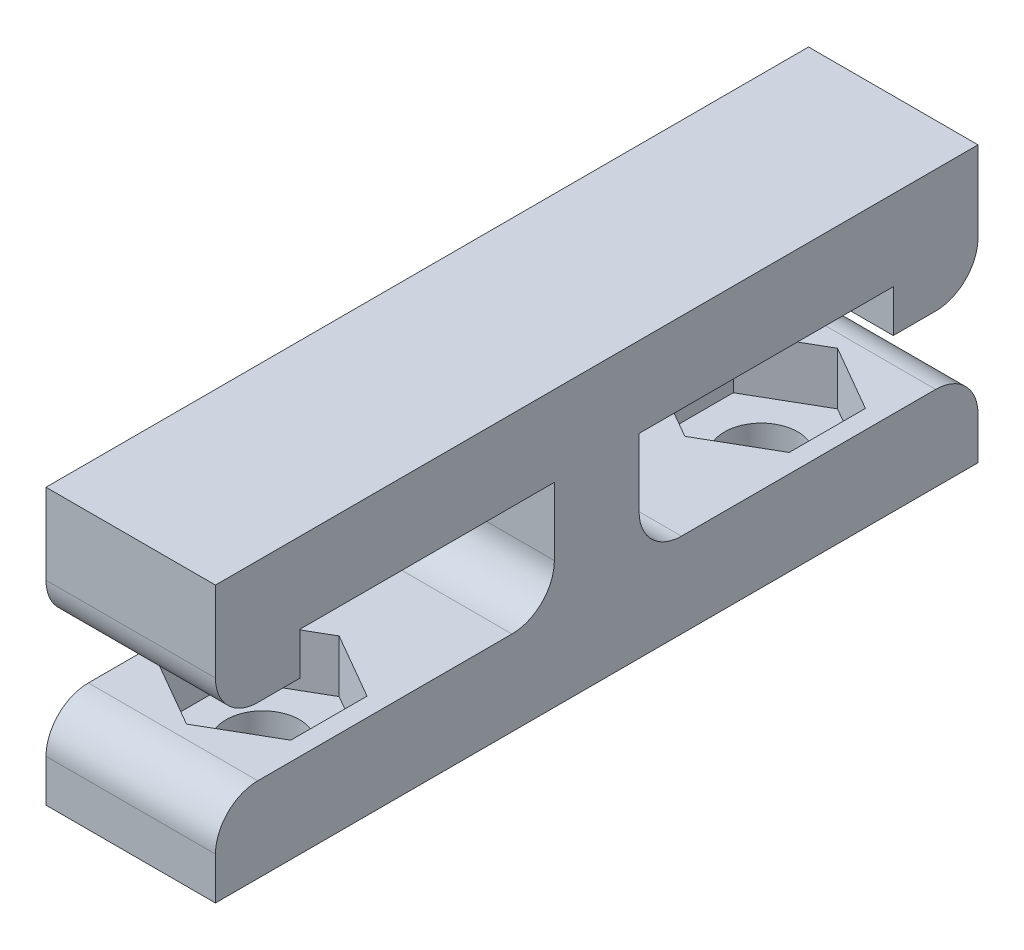
from build123d import *

# Parameters (mm, degrees)
SKETCH1_W           = 10
SKETCH1_H           = 45
SKETCH1_R           = 2.16
BOSS_EXTRUDE1_DEPTH = 5
CUT_EXTRUDE1_DEPTH  = 3.1
BOSS_EXTRUDE2_DEPTH = 10
FILLET1_R           = 2.5


with BuildPart() as part:
    # Sketch1 → Boss-Extrude1 (new body)
    with BuildSketch(Plane(origin=(0, 0, 0), x_dir=(1, 0, 0), z_dir=(0, 1, 0))):
        with Locations((5, 22.5)):
            Rectangle(SKETCH1_W, SKETCH1_H)
        with Locations(Location((5, 37.205, 0), (0, 0, 270))):
            Circle(SKETCH1_R, mode=Mode.SUBTRACT)
        with Locations(Location((5, 7.795, 0), (0, 0, 270))):
            Circle(SKETCH1_R, mode=Mode.SUBTRACT)
    extrude(amount=BOSS_EXTRUDE1_DEPTH)

    # Sketch2 → Cut-Extrude1 (cut)
    with BuildSketch(Plane(origin=(0, 5, 0), x_dir=(1, 0, 0), z_dir=(0, 1, 0))):
        Polygon((5, 32.7016679), (8.9, 34.95333395), (8.9, 39.45666605), (5, 41.7083321), (1.1, 39.45666605), (1.1, 34.95333395), align=None)
        Polygon((5, 12.2983321), (1.1, 10.04666605), (1.1, 5.54333395), (5, 3.2916679), (8.9, 5.54333395), (8.9, 10.04666605), align=None)
    extrude(amount=-CUT_EXTRUDE1_DEPTH, mode=Mode.SUBTRACT)

    # Sketch3 → Boss-Extrude2 (add, through all)
    with BuildSketch(Plane.ZY):
        Polygon((-25, 5), (-25, 11.5), (-40, 11.5), (-40, 9), (-45, 9), (-45, 16.25), (0, 16.25), (0, 9), (-5, 9), (-5, 11.5), (-20, 11.5), (-20, 5), align=None)
    extrude(amount=-BOSS_EXTRUDE2_DEPTH)

    # Fillet1
    fillet1_edges = [part.edges().sort_by_distance(p)[0] for p in [
        (5, 5, -45),
        (5, 5, -20),
        (5, 5, -25),
        (5, 9, -45),
        (5, 9, 0),
        (5, 5, 0),
    ]]
    fillet(fillet1_edges, radius=FILLET1_R)


solid = part.part
